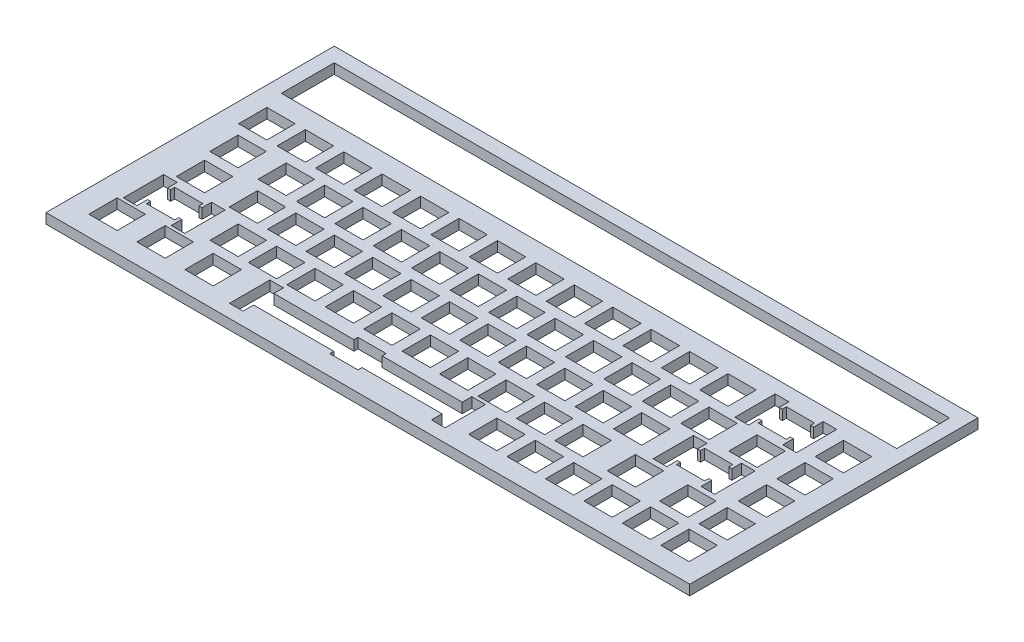
from build123d import *

# Parameters (mm, degrees)
SKETCH1_W           = 319.08
SKETCH1_H           = 142.875
SKETCH1_W_2         = 14
SKETCH1_H_2         = 14
SKETCH1_W_3         = 305
SKETCH1_H_3         = 26.2
BOSS_EXTRUDE1_DEPTH = 5


with BuildPart() as part:
    # Sketch1 → Boss-Extrude1 (new body)
    with BuildSketch(Plane(origin=(0, 0, 0), x_dir=(1, 0, 0), z_dir=(0, 1, 0))):
        with Locations((55.118496059, 23.552072889)):
            Rectangle(SKETCH1_W, SKETCH1_H)
        with Locations((-68.754503941, 44.995572889)):
            Rectangle(SKETCH1_W_2, SKETCH1_H_2, mode=Mode.SUBTRACT)
        with Locations((-87.826503941, 44.995572889)):
            Rectangle(SKETCH1_W_2, SKETCH1_H_2, mode=Mode.SUBTRACT)
        with Locations((140.749496059, 44.995572889)):
            Rectangle(SKETCH1_W_2, SKETCH1_H_2, mode=Mode.SUBTRACT)
        with Locations((-30.654503941, 44.995572889)):
            Rectangle(SKETCH1_W_2, SKETCH1_H_2, mode=Mode.SUBTRACT)
        with Locations((-49.704503941, 44.995572889)):
            Rectangle(SKETCH1_W_2, SKETCH1_H_2, mode=Mode.SUBTRACT)
        with Locations((7.445496059, 44.995572889)):
            Rectangle(SKETCH1_W_2, SKETCH1_H_2, mode=Mode.SUBTRACT)
        with Locations((-11.604503941, 44.995572889)):
            Rectangle(SKETCH1_W_2, SKETCH1_H_2, mode=Mode.SUBTRACT)
        with Locations((45.545496059, 44.995572889)):
            Rectangle(SKETCH1_W_2, SKETCH1_H_2, mode=Mode.SUBTRACT)
        with Locations((26.495496059, 44.995572889)):
            Rectangle(SKETCH1_W_2, SKETCH1_H_2, mode=Mode.SUBTRACT)
        with Locations((174.183496059, 25.945572889)):
            Rectangle(SKETCH1_W_2, SKETCH1_H_2, mode=Mode.SUBTRACT)
        with Locations((83.645496059, 44.995572889)):
            Rectangle(SKETCH1_W_2, SKETCH1_H_2, mode=Mode.SUBTRACT)
        with Locations((64.595496059, 44.995572889)):
            Rectangle(SKETCH1_W_2, SKETCH1_H_2, mode=Mode.SUBTRACT)
        with Locations((121.722496059, 44.995572889)):
            Rectangle(SKETCH1_W_2, SKETCH1_H_2, mode=Mode.SUBTRACT)
        with Locations((102.695496059, 44.995572889)):
            Rectangle(SKETCH1_W_2, SKETCH1_H_2, mode=Mode.SUBTRACT)
        Polygon((162.399496059, 52.245572889), (176.399496059, 52.245572889), (176.399496059, 50.245572889), (177.899496059, 50.245572889), (177.899496059, 54.995572889), (184.649496059, 54.995572889), (184.649496059, 34.995572889), (177.899496059, 34.995572889), (177.899496059, 40.245572889), (176.399496059, 40.245572889), (176.399496059, 38.245572889), (162.399496059, 38.245572889), (162.399496059, 40.245572889), (160.899496059, 40.245572889), (160.899496059, 34.995572889), (154.149496059, 34.995572889), (154.149496059, 54.995572889), (160.899496059, 54.995572889), (160.899496059, 50.245572889), (162.399496059, 50.245572889), align=None, mode=Mode.SUBTRACT)
        with Locations((-40.126503941, 25.945572889)):
            Rectangle(SKETCH1_W_2, SKETCH1_H_2, mode=Mode.SUBTRACT)
        with Locations((-59.176503941, 25.945572889)):
            Rectangle(SKETCH1_W_2, SKETCH1_H_2, mode=Mode.SUBTRACT)
        with Locations((-2.051503941, 25.945572889)):
            Rectangle(SKETCH1_W_2, SKETCH1_H_2, mode=Mode.SUBTRACT)
        with Locations((-21.076503941, 25.945572889)):
            Rectangle(SKETCH1_W_2, SKETCH1_H_2, mode=Mode.SUBTRACT)
        with Locations((36.073496059, 25.945572889)):
            Rectangle(SKETCH1_W_2, SKETCH1_H_2, mode=Mode.SUBTRACT)
        with Locations((16.948496059, 25.945572889)):
            Rectangle(SKETCH1_W_2, SKETCH1_H_2, mode=Mode.SUBTRACT)
        with Locations((74.148496059, 25.945572889)):
            Rectangle(SKETCH1_W_2, SKETCH1_H_2, mode=Mode.SUBTRACT)
        with Locations((55.123496059, 25.945572889)):
            Rectangle(SKETCH1_W_2, SKETCH1_H_2, mode=Mode.SUBTRACT)
        Polygon((159.986496059, 14.145572889), (173.986496059, 14.145572889), (173.986496059, 12.145572889), (175.486496059, 12.145572889), (175.486496059, 16.895572889), (182.236496059, 16.895572889), (182.236496059, -3.104427111), (175.486496059, -3.104427111), (175.486496059, 2.145572889), (173.986496059, 2.145572889), (173.986496059, 0.145572889), (159.986496059, 0.145572889), (159.986496059, 2.145572889), (158.486496059, 2.145572889), (158.486496059, -3.104427111), (151.736496059, -3.104427111), (151.736496059, 16.895572889), (158.486496059, 16.895572889), (158.486496059, 12.145572889), (159.986496059, 12.145572889), align=None, mode=Mode.SUBTRACT)
        with Locations((-35.363503941, 6.895572889)):
            Rectangle(SKETCH1_W_2, SKETCH1_H_2, mode=Mode.SUBTRACT)
        with Locations((-54.413503941, 6.895572889)):
            Rectangle(SKETCH1_W_2, SKETCH1_H_2, mode=Mode.SUBTRACT)
        with Locations((112.273496059, 25.945572889)):
            Rectangle(SKETCH1_W_2, SKETCH1_H_2, mode=Mode.SUBTRACT)
        with Locations((93.223496059, 25.945572889)):
            Rectangle(SKETCH1_W_2, SKETCH1_H_2, mode=Mode.SUBTRACT)
        with Locations((-83.063503941, 25.945572889)):
            Rectangle(SKETCH1_W_2, SKETCH1_H_2, mode=Mode.SUBTRACT)
        with Locations((131.323496059, 25.945572889)):
            Rectangle(SKETCH1_W_2, SKETCH1_H_2, mode=Mode.SUBTRACT)
        with Locations((150.373496059, 25.945572889)):
            Rectangle(SKETCH1_W_2, SKETCH1_H_2, mode=Mode.SUBTRACT)
        with Locations((2.736496059, 6.895572889)):
            Rectangle(SKETCH1_W_2, SKETCH1_H_2, mode=Mode.SUBTRACT)
        with Locations((-16.313503941, 6.895572889)):
            Rectangle(SKETCH1_W_2, SKETCH1_H_2, mode=Mode.SUBTRACT)
        with Locations((40.836496059, 6.895572889)):
            Rectangle(SKETCH1_W_2, SKETCH1_H_2, mode=Mode.SUBTRACT)
        with Locations((21.786496059, 6.895572889)):
            Rectangle(SKETCH1_W_2, SKETCH1_H_2, mode=Mode.SUBTRACT)
        with Locations((78.936496059, 6.895572889)):
            Rectangle(SKETCH1_W_2, SKETCH1_H_2, mode=Mode.SUBTRACT)
        with Locations((59.886496059, 6.895572889)):
            Rectangle(SKETCH1_W_2, SKETCH1_H_2, mode=Mode.SUBTRACT)
        with Locations((117.036496059, 6.895572889)):
            Rectangle(SKETCH1_W_2, SKETCH1_H_2, mode=Mode.SUBTRACT)
        with Locations((97.986496059, 6.895572889)):
            Rectangle(SKETCH1_W_2, SKETCH1_H_2, mode=Mode.SUBTRACT)
        with Locations((-80.607503941, 6.895572889)):
            Rectangle(SKETCH1_W_2, SKETCH1_H_2, mode=Mode.SUBTRACT)
        with Locations((136.086496059, 6.895572889)):
            Rectangle(SKETCH1_W_2, SKETCH1_H_2, mode=Mode.SUBTRACT)
        with Locations((-25.838503941, -12.154427111)):
            Rectangle(SKETCH1_W_2, SKETCH1_H_2, mode=Mode.SUBTRACT)
        with Locations((-44.888503941, -12.154427111)):
            Rectangle(SKETCH1_W_2, SKETCH1_H_2, mode=Mode.SUBTRACT)
        with Locations((12.261496059, -12.154427111)):
            Rectangle(SKETCH1_W_2, SKETCH1_H_2, mode=Mode.SUBTRACT)
        with Locations((-6.788503941, -12.154427111)):
            Rectangle(SKETCH1_W_2, SKETCH1_H_2, mode=Mode.SUBTRACT)
        with Locations((50.361496059, -12.154427111)):
            Rectangle(SKETCH1_W_2, SKETCH1_H_2, mode=Mode.SUBTRACT)
        with Locations((31.311496059, -12.154427111)):
            Rectangle(SKETCH1_W_2, SKETCH1_H_2, mode=Mode.SUBTRACT)
        with Locations((88.461496059, -12.654427111)):
            Rectangle(SKETCH1_W_2, SKETCH1_H_2, mode=Mode.SUBTRACT)
        with Locations((69.411496059, -12.654427111)):
            Rectangle(SKETCH1_W_2, SKETCH1_H_2, mode=Mode.SUBTRACT)
        with Locations((126.561496059, -12.654427111)):
            Rectangle(SKETCH1_W_2, SKETCH1_H_2, mode=Mode.SUBTRACT)
        with Locations((107.511496059, -12.654427111)):
            Rectangle(SKETCH1_W_2, SKETCH1_H_2, mode=Mode.SUBTRACT)
        Polygon((-83.344503941, -5.154427111), (-69.344503941, -5.154427111), (-69.344503941, -7.154427111), (-67.844503941, -7.154427111), (-67.844503941, -2.404427111), (-61.094503941, -2.404427111), (-61.094503941, -22.404427111), (-67.844503941, -22.404427111), (-67.844503941, -17.154427111), (-69.344503941, -17.154427111), (-69.344503941, -19.154427111), (-83.344503941, -19.154427111), (-83.344503941, -17.154427111), (-84.844503941, -17.154427111), (-84.844503941, -22.404427111), (-91.594503941, -22.404427111), (-91.594503941, -2.404427111), (-84.844503941, -2.404427111), (-84.844503941, -7.154427111), (-83.344503941, -7.154427111), align=None, mode=Mode.SUBTRACT)
        with Locations((152.523496059, -12.654427111)):
            Rectangle(SKETCH1_W_2, SKETCH1_H_2, mode=Mode.SUBTRACT)
        with Locations((178.485496059, -12.654427111)):
            Rectangle(SKETCH1_W_2, SKETCH1_H_2, mode=Mode.SUBTRACT)
        with Locations((55.223496059, 74.745572889)):
            Rectangle(SKETCH1_W_3, SKETCH1_H_3, mode=Mode.SUBTRACT)
        with Locations((197.995496059, 25.945572889)):
            Rectangle(SKETCH1_W_2, SKETCH1_H_2, mode=Mode.SUBTRACT)
        with Locations((197.974496059, 44.995572889)):
            Rectangle(SKETCH1_W_2, SKETCH1_H_2, mode=Mode.SUBTRACT)
        with Locations((197.942496059, 6.895572889)):
            Rectangle(SKETCH1_W_2, SKETCH1_H_2, mode=Mode.SUBTRACT)
        with Locations((197.985496059, -12.654427111)):
            Rectangle(SKETCH1_W_2, SKETCH1_H_2, mode=Mode.SUBTRACT)
        with Locations((-86.094503941, -30.954427111)):
            Rectangle(SKETCH1_W_2, SKETCH1_H_2, mode=Mode.SUBTRACT)
        with Locations((-62.294503941, -30.954427111)):
            Rectangle(SKETCH1_W_2, SKETCH1_H_2, mode=Mode.SUBTRACT)
        with Locations((-38.494503941, -30.954427111)):
            Rectangle(SKETCH1_W_2, SKETCH1_H_2, mode=Mode.SUBTRACT)
        Polygon((26.439496059, -24.114427111), (40.439496059, -24.114427111), (40.439496059, -26.114427111), (80.123496059, -26.114427111), (80.123496059, -21.364427111), (86.873496059, -21.364427111), (86.873496059, -41.364427111), (80.123496059, -41.364427111), (80.123496059, -36.114427111), (40.439496059, -36.114427111), (40.439496059, -38.114427111), (26.439496059, -38.114427111), (26.439496059, -36.114427111), (-13.244503941, -36.114427111), (-13.244503941, -41.364427111), (-19.994503941, -41.364427111), (-19.994503941, -21.364427111), (-13.244503941, -21.364427111), (-13.244503941, -26.114427111), (26.439496059, -26.114427111), align=None, mode=Mode.SUBTRACT)
        with Locations((102.543496059, -31.364427111)):
            Rectangle(SKETCH1_W_2, SKETCH1_H_2, mode=Mode.SUBTRACT)
        with Locations((121.593496059, -31.364427111)):
            Rectangle(SKETCH1_W_2, SKETCH1_H_2, mode=Mode.SUBTRACT)
        with Locations((140.643496059, -31.364427111)):
            Rectangle(SKETCH1_W_2, SKETCH1_H_2, mode=Mode.SUBTRACT)
        with Locations((159.693496059, -31.364427111)):
            Rectangle(SKETCH1_W_2, SKETCH1_H_2, mode=Mode.SUBTRACT)
        with Locations((178.743496059, -31.364427111)):
            Rectangle(SKETCH1_W_2, SKETCH1_H_2, mode=Mode.SUBTRACT)
        with Locations((197.793496059, -31.364427111)):
            Rectangle(SKETCH1_W_2, SKETCH1_H_2, mode=Mode.SUBTRACT)
    extrude(amount=-BOSS_EXTRUDE1_DEPTH)


solid = part.part
